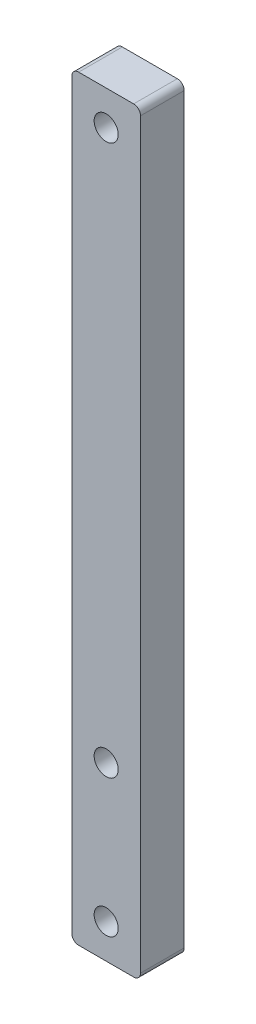
from build123d import *

# Parameters (mm, degrees)
SKETCH1_R           = 1.75
BOSS_EXTRUDE1_DEPTH = 6.35
SKETCH2_R           = 1.75
CUT_EXTRUDE1_DEPTH  = 10


with BuildPart() as part:
    # Sketch1 → Boss-Extrude1 (new body)
    with BuildSketch(Plane.XY):
        with BuildLine():
            Line((0, 1), (0, 109))
            ThreePointArc((0, 109), (0.292893219, 109.707106781), (1, 110))
            Line((1, 110), (9, 110))
            ThreePointArc((9, 110), (9.707106781, 109.707106781), (10, 109))
            Line((10, 109), (10, 1))
            ThreePointArc((10, 1), (9.707106781, 0.292893219), (9, 0))
            Line((9, 0), (1, 0))
            ThreePointArc((1, 0), (0.292893219, 0.292893219), (0, 1))
        make_face()
        with Locations((5, 105)):
            Circle(SKETCH1_R, mode=Mode.SUBTRACT)
        with Locations((5, 5)):
            Circle(SKETCH1_R, mode=Mode.SUBTRACT)
    extrude(amount=BOSS_EXTRUDE1_DEPTH)

    # Sketch2 → Cut-Extrude1 (cut)
    with BuildSketch(Plane.XY.offset(6.35)):
        with Locations((5, 25)):
            Circle(SKETCH2_R)
    extrude(amount=-CUT_EXTRUDE1_DEPTH, mode=Mode.SUBTRACT)


solid = part.part
